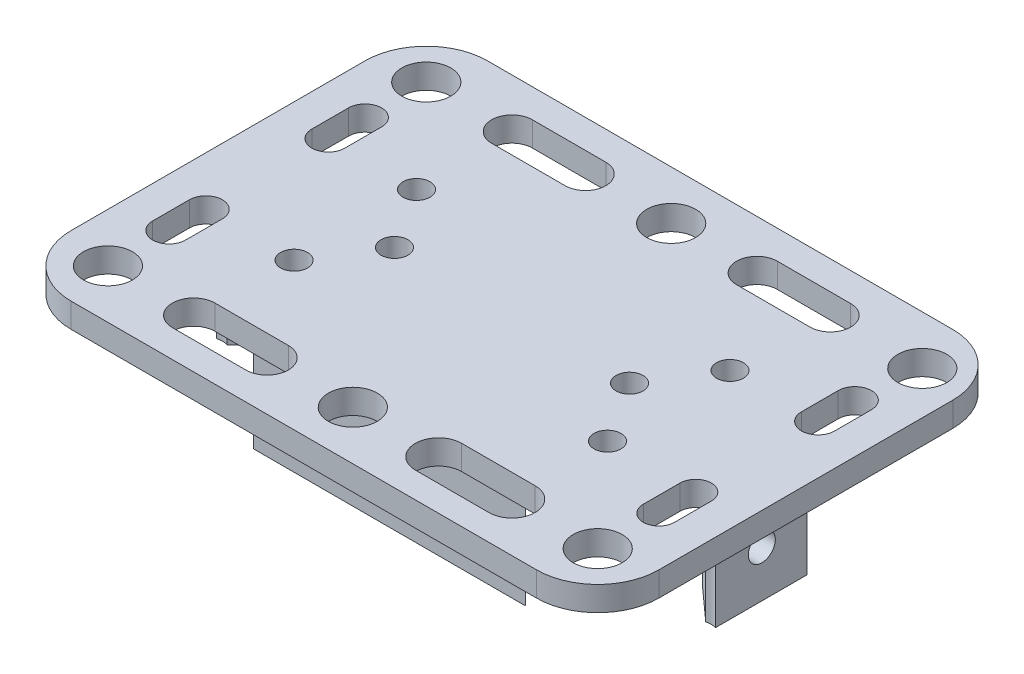
from build123d import *

# Parameters (mm, degrees)
SKETCH2_W            = 60
SKETCH2_H            = 85
BOSS_EXTRUDE1_DEPTH  = 5
BOSS_EXTRUDE2_DEPTH  = 20
BOSS_EXTRUDE3_DEPTH  = 20
FILLET1_R            = 10
FILLET2_R            = 5
FILLET3_R            = 12.5
FILLET1_OF_MIRROR1_R = 10
FILLET2_OF_MIRROR1_R = 5
FILLET3_OF_MIRROR1_R = 12.5
SKETCH4_R            = 5
CUT_EXTRUDE1_DEPTH   = 78.661122835
SKETCH5_R            = 2.75
CUT_EXTRUDE2_DEPTH   = 121.538251605
SKETCH6_R            = 2.75
CUT_EXTRUDE3_DEPTH   = 10


with BuildPart() as part:
    # Sketch2 → Boss-Extrude1 (new body)
    with BuildSketch(Plane(origin=(0, 0, 0), x_dir=(1, 0, 0), z_dir=(0, 1, 0))):
        with Locations((30, 0)):
            Rectangle(SKETCH2_W, SKETCH2_H)
    boss_extrude1 = extrude(amount=BOSS_EXTRUDE1_DEPTH)

    # Sketch3 → Boss-Extrude2 (add)
    with BuildSketch(Plane.XZ):
        Polygon((0, 25), (0, -25), (27.775312871, -25), (0.01, 0), (27.775312871, 25), align=None)
        Polygon((38.51, 0), (51.01, 11.255050554), (51.01, -11.255050554), align=None)
    boss_extrude2 = extrude(amount=BOSS_EXTRUDE2_DEPTH)

    # Sketch3<2> → Boss-Extrude3 (add)
    with BuildSketch(Plane.XZ):
        Polygon((0, 25), (0, -25), (27.775312871, -25), (0.01, 0), (27.775312871, 25), align=None)
        Polygon((38.51, 0), (51.01, 11.255050554), (51.01, -11.255050554), align=None)
    boss_extrude3 = extrude(amount=BOSS_EXTRUDE3_DEPTH)

    # Fillet1
    fillet1_edges = [part.edges().sort_by_distance(p)[0] for p in [
        (0.01, -10, 0),
    ]]
    fillet(fillet1_edges, radius=FILLET1_R)

    # Fillet2
    fillet2_edges = [part.edges().sort_by_distance(p)[0] for p in [
        (38.51, -10, 0),
    ]]
    fillet(fillet2_edges, radius=FILLET2_R)

    # Fillet3
    fillet3_edges = [part.edges().sort_by_distance(p)[0] for p in [
        (60, 2.5, 42.5),
        (60, 2.5, -42.5),
    ]]
    fillet(fillet3_edges, radius=FILLET3_R)

    # Mirror1: Boss-Extrude1, Boss-Extrude2, Boss-Extrude3 across plane
    add(boss_extrude1.mirror(Plane(origin=(0, 0, 0), x_dir=(0, 0, 1), z_dir=(1, 0, 0))))
    add(boss_extrude2.mirror(Plane(origin=(0, 0, 0), x_dir=(0, 0, 1), z_dir=(1, 0, 0))))
    add(boss_extrude3.mirror(Plane(origin=(0, 0, 0), x_dir=(0, 0, 1), z_dir=(1, 0, 0))))

    # Fillet1 of Mirror1
    fillet1_of_mirror1_edges = [part.edges().sort_by_distance(p)[0] for p in [
        (-0.01, -10, 0),
    ]]
    fillet(fillet1_of_mirror1_edges, radius=FILLET1_OF_MIRROR1_R)

    # Fillet2 of Mirror1
    fillet2_of_mirror1_edges = [part.edges().sort_by_distance(p)[0] for p in [
        (-38.51, -10, 0),
    ]]
    fillet(fillet2_of_mirror1_edges, radius=FILLET2_OF_MIRROR1_R)

    # Fillet3 of Mirror1
    fillet3_of_mirror1_edges = [part.edges().sort_by_distance(p)[0] for p in [
        (-60, 2.5, 42.5),
        (-60, 2.5, -42.5),
    ]]
    fillet(fillet3_of_mirror1_edges, radius=FILLET3_OF_MIRROR1_R)

    # Sketch4 → Cut-Extrude1 (cut, through all)
    with BuildSketch(Plane(origin=(0, 5, 0), x_dir=(1, 0, 0), z_dir=(0, 1, 0))):
        with Locations((-50, 32.5)):
            Circle(SKETCH4_R)
        with Locations((0, 32.5)):
            Circle(SKETCH4_R)
        with Locations((51.276477942, 32.5)):
            Circle(SKETCH4_R)
        with Locations((50, -32.5)):
            Circle(SKETCH4_R)
        with Locations((0, -32.5)):
            Circle(SKETCH4_R)
        with Locations((-50, -32.5)):
            Circle(SKETCH4_R)
        with BuildLine():
            Line((-32.5, 36.657579216), (-17.5, 36.657579216))
            ThreePointArc((-17.5, 36.657579216), (-13.342420784, 32.5), (-17.5, 28.342420784))
            Line((-17.5, 28.342420784), (-32.5, 28.342420784))
            ThreePointArc((-32.5, 28.342420784), (-36.657579216, 32.5), (-32.5, 36.657579216))
        make_face()
        with BuildLine():
            Line((17.5, 36.657579216), (32.5, 36.657579216))
            ThreePointArc((32.5, 36.657579216), (36.657579216, 32.5), (32.5, 28.342420784))
            Line((32.5, 28.342420784), (17.5, 28.342420784))
            ThreePointArc((17.5, 28.342420784), (13.342420784, 32.5), (17.5, 36.657579216))
        make_face()
        with BuildLine():
            Line((17.5, -27.766798153), (32.5, -27.766798153))
            ThreePointArc((32.5, -27.766798153), (37.233201847, -32.5), (32.5, -37.233201847))
            Line((32.5, -37.233201847), (17.5, -37.233201847))
            ThreePointArc((17.5, -37.233201847), (12.766798153, -32.5), (17.5, -27.766798153))
        make_face()
        with BuildLine():
            Line((-32.5, -28.155970988), (-17.5, -28.155970988))
            ThreePointArc((-17.5, -28.155970988), (-13.155970988, -32.5), (-17.5, -36.844029012))
            Line((-17.5, -36.844029012), (-32.5, -36.844029012))
            ThreePointArc((-32.5, -36.844029012), (-36.844029012, -32.5), (-32.5, -28.155970988))
        make_face()
        with BuildLine():
            Line((46.805058654, -20), (46.805058654, -12.5))
            ThreePointArc((46.805058654, -12.5), (50, -9.305058654), (53.194941346, -12.5))
            Line((53.194941346, -12.5), (53.194941346, -20))
            ThreePointArc((53.194941346, -20), (50, -23.194941346), (46.805058654, -20))
        make_face()
        with BuildLine():
            Line((53.389527763, 20), (53.389527763, 12.5))
            ThreePointArc((53.389527763, 12.5), (50, 9.110472237), (46.610472237, 12.5))
            Line((46.610472237, 12.5), (46.610472237, 20))
            ThreePointArc((46.610472237, 20), (50, 23.389527763), (53.389527763, 20))
        make_face()
        with BuildLine():
            Line((-46.62789073, 20), (-46.62789073, 12.5))
            ThreePointArc((-46.62789073, 12.5), (-50, 9.12789073), (-53.37210927, 12.5))
            Line((-53.37210927, 12.5), (-53.37210927, 20))
            ThreePointArc((-53.37210927, 20), (-50, 23.37210927), (-46.62789073, 20))
        make_face()
        with BuildLine():
            Line((-46.62789073, -12.5), (-46.62789073, -20))
            ThreePointArc((-46.62789073, -20), (-50, -23.37210927), (-53.37210927, -20))
            Line((-53.37210927, -20), (-53.37210927, -12.5))
            ThreePointArc((-53.37210927, -12.5), (-50, -9.12789073), (-46.62789073, -12.5))
        make_face()
    extrude(amount=-CUT_EXTRUDE1_DEPTH, mode=Mode.SUBTRACT)

    # Sketch5 → Cut-Extrude2 (cut, through all)
    with BuildSketch(Plane(origin=(51.01, 0, 0), x_dir=(0, 0, -1), z_dir=(1, 0, 0))):
        with Locations((0, -10.5)):
            Circle(SKETCH5_R)
    extrude(amount=-CUT_EXTRUDE2_DEPTH, mode=Mode.SUBTRACT)

    # Sketch6 → Cut-Extrude3 (cut)
    with BuildSketch(Plane.XZ):
        with Locations((32, 12.5)):
            Circle(SKETCH6_R)
        with Locations((24, 0)):
            Circle(SKETCH6_R)
        with Locations((32, -12.5)):
            Circle(SKETCH6_R)
        with Locations((-32, 12.5)):
            Circle(SKETCH6_R)
        with Locations((-24, 0)):
            Circle(SKETCH6_R)
        with Locations((-32, -12.5)):
            Circle(SKETCH6_R)
    extrude(amount=-CUT_EXTRUDE3_DEPTH, mode=Mode.SUBTRACT)


solid = part.part
